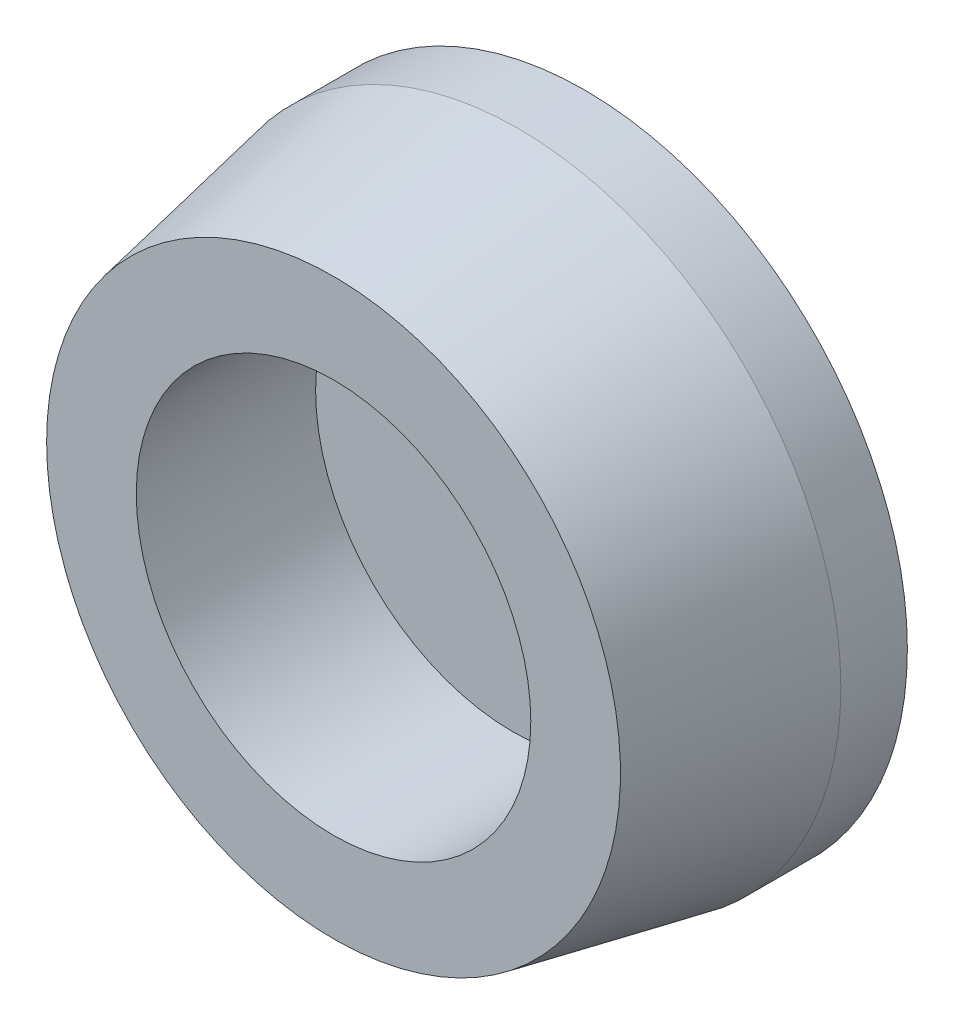
from build123d import *

# Parameters (mm, degrees)
SKETCH1_R           = 9
BOSS_EXTRUDE1_DEPTH = 7
SKETCH2_R           = 5.5
CUT_EXTRUDE1_DEPTH  = 5
CHAMFER1_SIZE       = 1
CHAMFER1_SIZE2      = 5.144554016


with BuildPart() as part:
    # Sketch1 → Boss-Extrude1 (new body)
    with BuildSketch(Plane.XY):
        Circle(SKETCH1_R)
    extrude(amount=BOSS_EXTRUDE1_DEPTH)

    # Sketch2 → Cut-Extrude1 (cut)
    with BuildSketch(Plane.XY.offset(7)):
        Circle(SKETCH2_R)
    extrude(amount=-CUT_EXTRUDE1_DEPTH, mode=Mode.SUBTRACT)

    # Chamfer1
    chamfer1_edges = [part.edges().sort_by_distance(p)[0] for p in [
        (-9, 0, 7),
    ]]
    chamfer1_side = [part.faces().sort_by_distance(p)[0] for p in [
        (-8.745441559, 0, 7),
    ]]
    chamfer(chamfer1_edges, length=CHAMFER1_SIZE, length2=CHAMFER1_SIZE2, reference=chamfer1_side[0])


solid = part.part
